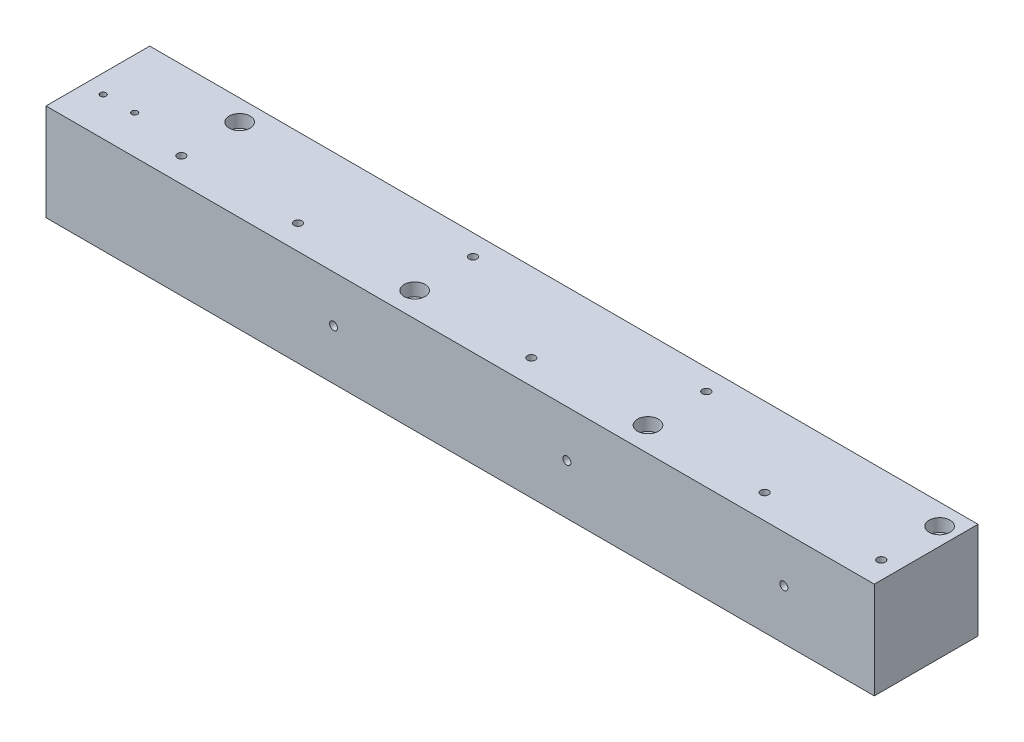
from build123d import *

# Parameters (mm, degrees)
SKETCH1_W                                            = 710
SKETCH1_H                                            = 83
BOSS_EXTRUDE1_DEPTH                                  = 88.9
M8_TAPPED_HOLE1_D                                    = 6.8
M8_TAPPED_HOLE1_DEPTH                                = 32.99
M8_TAPPED_HOLE1_TIP                                  = 2.042926105
CBORE_FOR_M10_HEX_SOCKET_HEAD_CAP_SCREW1_D           = 11
CBORE_FOR_M10_HEX_SOCKET_HEAD_CAP_SCREW1_CBORE_D     = 18
CBORE_FOR_M10_HEX_SOCKET_HEAD_CAP_SCREW1_CBORE_DEPTH = 11
M6_TAPPED_HOLE1_D                                    = 5
M6_TAPPED_HOLE1_DEPTH                                = 21.35
M6_TAPPED_HOLE1_TIP                                  = 1.502151548
M8_TAPPED_HOLE2_D                                    = 6.8
M8_TAPPED_HOLE2_DEPTH                                = 32.99
M8_TAPPED_HOLE2_TIP                                  = 2.042926105


with BuildPart() as part:
    # Sketch1 → Boss-Extrude1 (new body)
    with BuildSketch(Plane.XY):
        with Locations((355, 41.5)):
            Rectangle(SKETCH1_W, SKETCH1_H)
    extrude(amount=BOSS_EXTRUDE1_DEPTH)

    # M8 Tapped Hole1
    with Locations(Plane(origin=(0, 83, 0), x_dir=(1, 0, 0), z_dir=(0, 1, 0))):
        with Locations((95, -67.9), (195, -67.9), (295, -17.9), (395, -67.9), (495, -17.9), (595, -67.9), (695, -67.9)):
            Hole(M8_TAPPED_HOLE1_D / 2, depth=M8_TAPPED_HOLE1_DEPTH)
            with Locations((0, 0, -(M8_TAPPED_HOLE1_DEPTH + M8_TAPPED_HOLE1_TIP / 2))):  # 118° drill point
                Cone(0, M8_TAPPED_HOLE1_D / 2, M8_TAPPED_HOLE1_TIP, mode=Mode.SUBTRACT)

    # CBORE for M10 Hex Socket Head Cap Screw1 (through all)
    with Locations(Plane(origin=(0, 83, 0), x_dir=(1, 0, 0), z_dir=(0, 1, 0))):
        with Locations((695, -17.9), (495, -67.9), (295, -67.9), (95, -17.9)):
            CounterBoreHole(CBORE_FOR_M10_HEX_SOCKET_HEAD_CAP_SCREW1_D / 2, CBORE_FOR_M10_HEX_SOCKET_HEAD_CAP_SCREW1_CBORE_D / 2, CBORE_FOR_M10_HEX_SOCKET_HEAD_CAP_SCREW1_CBORE_DEPTH)

    # M6 Tapped Hole1
    with Locations(Plane(origin=(0, 83, 0), x_dir=(1, 0, 0), z_dir=(0, 1, 0))):
        with Locations((16, -55.9), (43, -55.9)):
            Hole(M6_TAPPED_HOLE1_D / 2, depth=M6_TAPPED_HOLE1_DEPTH)
            with Locations((0, 0, -(M6_TAPPED_HOLE1_DEPTH + M6_TAPPED_HOLE1_TIP / 2))):  # 118° drill point
                Cone(0, M6_TAPPED_HOLE1_D / 2, M6_TAPPED_HOLE1_TIP, mode=Mode.SUBTRACT)

    # M8 Tapped Hole2
    with Locations(Plane.XY.offset(88.9)):
        with Locations((246.5, 43), (446.5, 43), (632.5, 43)):
            Hole(M8_TAPPED_HOLE2_D / 2, depth=M8_TAPPED_HOLE2_DEPTH)
            with Locations((0, 0, -(M8_TAPPED_HOLE2_DEPTH + M8_TAPPED_HOLE2_TIP / 2))):  # 118° drill point
                Cone(0, M8_TAPPED_HOLE2_D / 2, M8_TAPPED_HOLE2_TIP, mode=Mode.SUBTRACT)


solid = part.part
